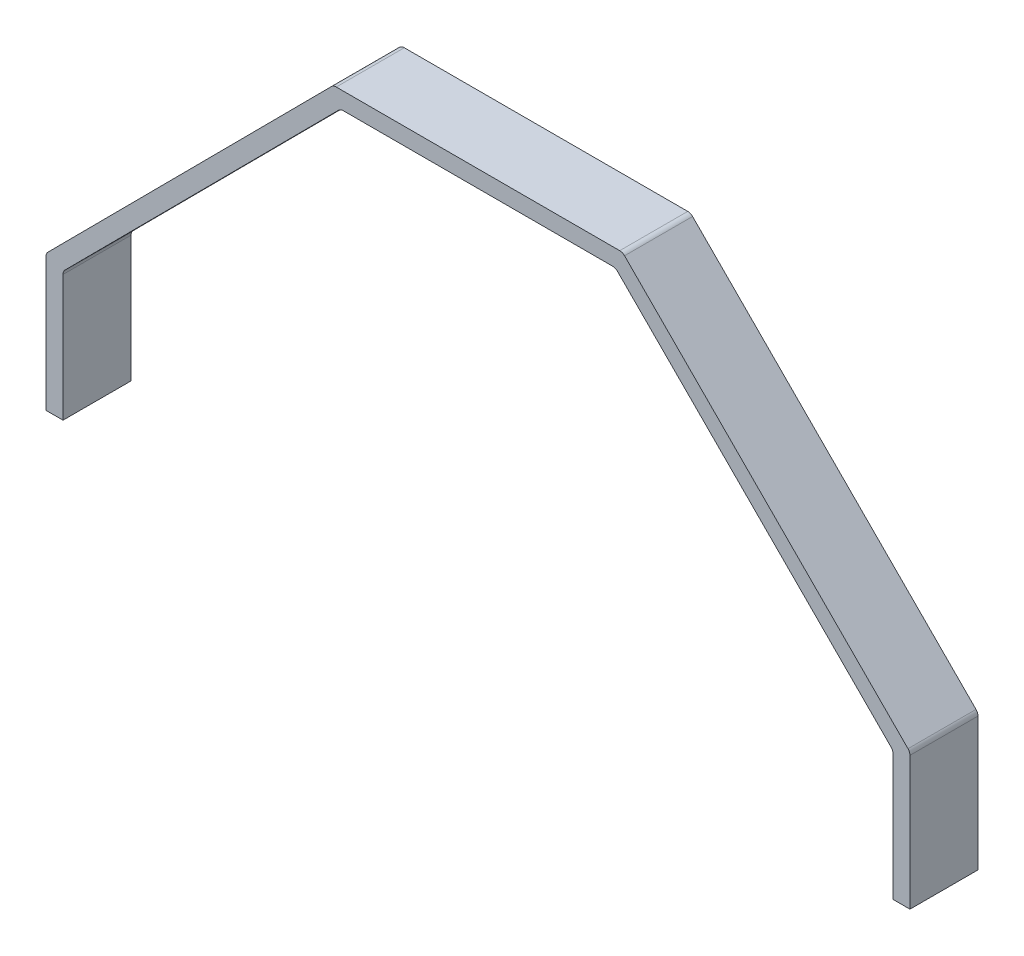
from build123d import *

# Parameters (mm, degrees)
BOSS_EXTRUDE1_DEPTH = 20
FILLET1_R           = 2


with BuildPart() as part:
    # Sketch1 → Boss-Extrude1 (new body)
    with BuildSketch(Plane.XY):
        Polygon((42.5, 0), (-42.5, 0), (-127, -85), (-127, -125), (-122, -125), (-122, -87.062433188), (-40.420287007, -5), (40.420287007, -5), (122, -87.062433188), (122, -125), (127, -125), (127, -85), align=None)
    extrude(amount=BOSS_EXTRUDE1_DEPTH)

    # Fillet1
    fillet1_edges = [part.edges().sort_by_distance(p)[0] for p in [
        (122, -87.062433188, 10),
        (40.420287007, -5, 10),
        (-40.420287007, -5, 10),
        (-122, -87.062433188, 10),
        (-127, -85, 10),
        (-42.5, 0, 10),
        (42.5, 0, 10),
        (127, -85, 10),
    ]]
    fillet(fillet1_edges, radius=FILLET1_R)


solid = part.part
